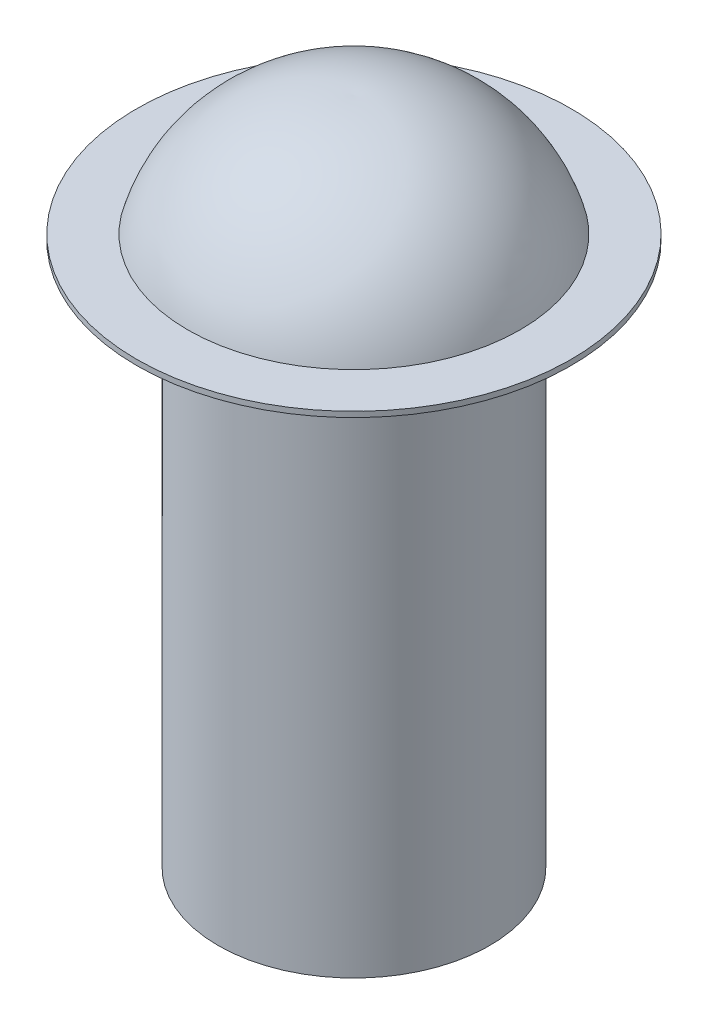
from build123d import *

# Parameters (mm, degrees)
SKETCH1_R           = 3.175
BOSS_EXTRUDE1_DEPTH = 12.7
SKETCH2_R           = 5.08
BOSS_EXTRUDE2_DEPTH = 0.127


with BuildPart() as part:
    # Sketch1 → Boss-Extrude1 (new body)
    with BuildSketch(Plane(origin=(0, 0, 0), x_dir=(1, 0, 0), z_dir=(0, 1, 0))):
        with Locations(Location((0, 0, 0), (0, 0, 270))):
            Circle(SKETCH1_R)
    extrude(amount=BOSS_EXTRUDE1_DEPTH)

    # Sketch2 → Boss-Extrude2 (add)
    with BuildSketch(Plane(origin=(0, 12.7, 0), x_dir=(1, 0, 0), z_dir=(0, 1, 0))):
        with Locations(Location((0, 0, 0), (0, 0, 270))):
            Circle(SKETCH2_R)
    extrude(amount=BOSS_EXTRUDE2_DEPTH)

    # Sketch3 → Revolve1 (revolve)
    with BuildSketch(Plane.XY):
        with BuildLine():
            Line((0, 12.827), (-3.886329239, 12.827))
            ThreePointArc((-3.886329239, 12.827), (-2.434866775, 14.914777268), (0, 15.647567139))
            Line((0, 15.647567139), (0, 12.827))
        make_face()
    revolve(axis=Axis((0, 12.827, 0), (0, 1, 0)))


solid = part.part
